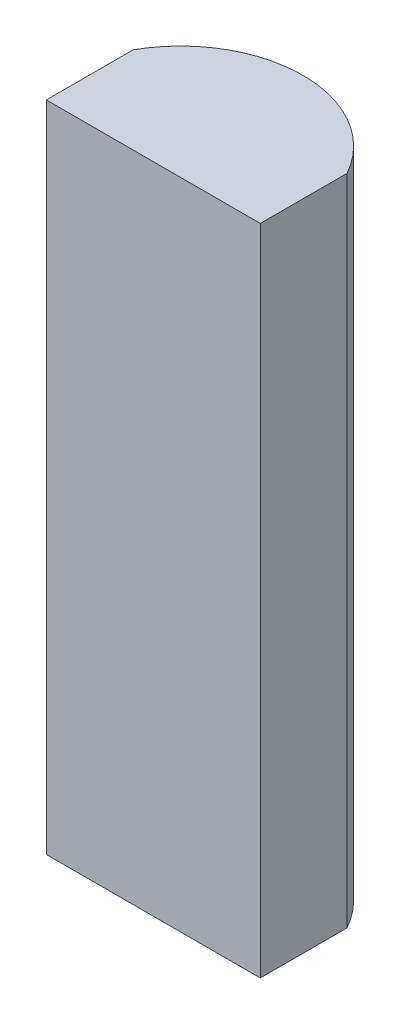
from build123d import *

# Parameters (mm, degrees)
BOSS_EXTRUDE1_DEPTH = 380


with BuildPart() as part:
    # Sketch1 → Boss-Extrude1 (new body)
    with BuildSketch(Plane(origin=(0, 0, 0), x_dir=(1, 0, 0), z_dir=(0, 1, 0))):
        with BuildLine():
            Line((-62.2, -15.8), (62.2, -15.8))
            Line((62.2, -15.8), (62.2, 34.649675323))
            ThreePointArc((62.2, 34.649675323), (0, 71.2), (-62.2, 34.649675323))
            Line((-62.2, 34.649675323), (-62.2, -15.8))
        make_face()
    extrude(amount=BOSS_EXTRUDE1_DEPTH)


solid = part.part
